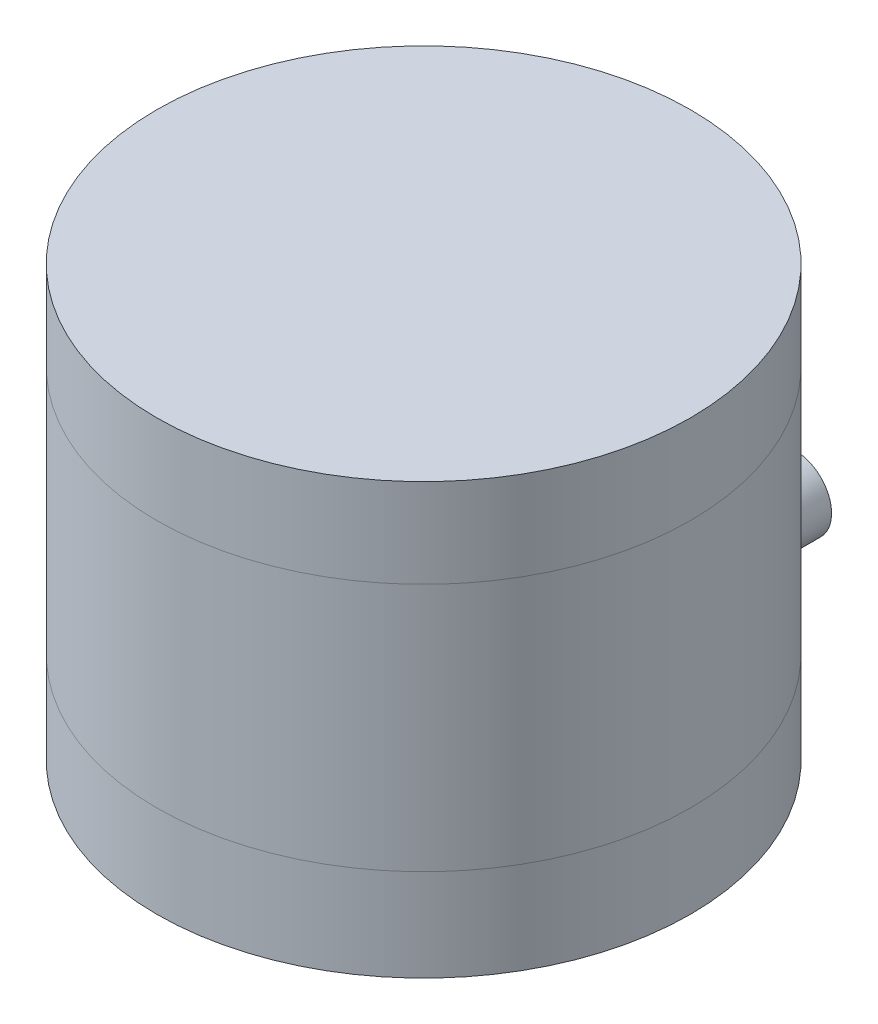
from build123d import *

# Parameters (mm, degrees)
SKETCH1_R           = 50.4
BOSS_EXTRUDE1_DEPTH = 17.4
SKETCH2_R           = 50.4
BOSS_EXTRUDE4_DEPTH = 47
SKETCH3_R           = 50.4
BOSS_EXTRUDE5_DEPTH = 16.8
BOSS_EXTRUDE7_DEPTH = 17.4
BOSS_EXTRUDE8_DEPTH = 2.4
SKETCH7_R           = 6.840256055
BOSS_EXTRUDE9_DEPTH = 13.4


with BuildPart() as part:
    # Sketch1 → Boss-Extrude1 (new body)
    with BuildSketch(Plane(origin=(0, 0, 0), x_dir=(1, 0, 0), z_dir=(0, 1, 0))):
        with Locations(Location((0, 0, 0), (0, 0, 270))):
            Circle(SKETCH1_R)
    extrude(amount=BOSS_EXTRUDE1_DEPTH)


with BuildPart() as body_2:
    # Sketch2 → Boss-Extrude4 (new body)
    with BuildSketch(Plane(origin=(0, 17.4, 0), x_dir=(1, 0, 0), z_dir=(0, 1, 0))):
        with Locations(Location((0, 0, 0), (0, 0, 270))):
            Circle(SKETCH2_R)
    extrude(amount=BOSS_EXTRUDE4_DEPTH)


with BuildPart() as body_3:
    # Sketch3 → Boss-Extrude5 (new body)
    with BuildSketch(Plane(origin=(0, 64.4, 0), x_dir=(1, 0, 0), z_dir=(0, 1, 0))):
        with Locations(Location((0, 0, 0), (0, 0, 270))):
            Circle(SKETCH3_R)
    extrude(amount=BOSS_EXTRUDE5_DEPTH)


with BuildPart() as body_4:
    # Sketch5 → Boss-Extrude7 (new body)
    with BuildSketch(Plane.XZ):
        with BuildLine():
            Line((-9.276969029, -54.4), (9.276969029, -54.4))
            add(Edge.make_bspline(
                [(11.118948593, -49.15820361), (8.792277398, -50.457107312), (10.573380416, -52.761094985), (9.276969029, -54.4)],
                knots=[0, 0, 0, 0, 1, 1, 1, 1], degree=3))
            Line((11.118948593, -49.15820361), (-11.118948593, -49.15820361))
            add(Edge.make_bspline(
                [(-11.118948593, -49.15820361), (-8.792277398, -50.457107312), (-10.573380416, -52.761094985), (-9.276969029, -54.4)],
                knots=[0, 0, 0, 0, 1, 1, 1, 1], degree=3))
        make_face()
    extrude(amount=-BOSS_EXTRUDE7_DEPTH)

    # Sketch6 → Boss-Extrude8 (add)
    with BuildSketch(Plane(origin=(0, 0, -54.4), x_dir=(-1, 0, 0), z_dir=(0, 0, -1))):
        Polygon((0, 17.249859203), (-7.404395268, 12.974929601), (-7.404395268, 4.425070399), (0, 0.150140797), (7.404395268, 4.425070399), (7.404395268, 12.974929601), align=None)
    extrude(amount=BOSS_EXTRUDE8_DEPTH)

    # Sketch7 → Boss-Extrude9 (add)
    with BuildSketch(Plane(origin=(0, 0, -56.8), x_dir=(-1, 0, 0), z_dir=(0, 0, -1))):
        with Locations((0, 8.7)):
            Circle(SKETCH7_R)
    extrude(amount=BOSS_EXTRUDE9_DEPTH)


solid = Compound([part.part, body_2.part, body_3.part, body_4.part])
